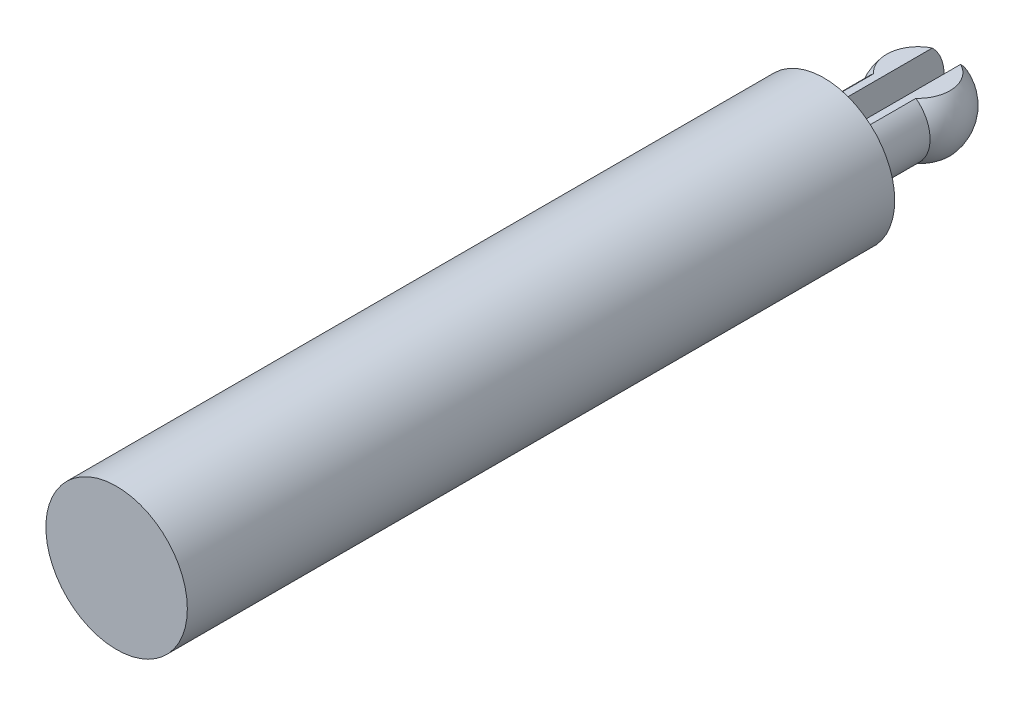
from build123d import *

# Parameters (mm, degrees)
SKETCH1_R           = 5
BOSS_EXTRUDE1_DEPTH = 50
SKETCH4_R           = 2.5
BOSS_EXTRUDE3_DEPTH = 5
SKETCH10_W          = 2
SKETCH10_H          = 10.578661844
CUT_EXTRUDE4_DEPTH  = 51.497524692
SKETCH11_W          = 10
SKETCH11_H          = 0.828427125
CUT_EXTRUDE5_DEPTH  = 51.497524692


with BuildPart() as part:
    # Sketch1 → Boss-Extrude1 (new body)
    with BuildSketch(Plane.XY):
        Circle(SKETCH1_R)
    extrude(amount=BOSS_EXTRUDE1_DEPTH)

    # Sketch4 → Boss-Extrude3 (add)
    with BuildSketch(Plane(origin=(0, 0, 0), x_dir=(-1, 0, 0), z_dir=(0, 0, -1))):
        Circle(SKETCH4_R)
    extrude(amount=BOSS_EXTRUDE3_DEPTH)

    # Sketch8 → Revolve1 (revolve)
    with BuildSketch(Plane(origin=(0, 0, 0), x_dir=(0, 0, -1), z_dir=(1, 0, 0))):
        with BuildLine():
            Line((6.658312395, 3), (6.658312395, -3))
            ThreePointArc((6.658312395, -3), (3.658312395, 0), (6.658312395, 3))
        make_face()
    revolve(axis=Axis((0, 3, -6.658312395), (0, -1, 0)))

    # Sketch10 → Cut-Extrude4 (cut, through all)
    with BuildSketch(Plane(origin=(0, 0, 0), x_dir=(-1, 0, 0), z_dir=(0, 0, -1))):
        Rectangle(SKETCH10_W, SKETCH10_H)
    extrude(amount=CUT_EXTRUDE4_DEPTH, mode=Mode.SUBTRACT)

    # Sketch11 → Cut-Extrude5 (cut, through all)
    with BuildSketch(Plane(origin=(0, 0, 0), x_dir=(-1, 0, 0), z_dir=(0, 0, -1))):
        with Locations((0, 2.414213563)):
            Rectangle(SKETCH11_W, SKETCH11_H)
        with Locations((0, -2.414213563)):
            Rectangle(SKETCH11_W, SKETCH11_H)
    extrude(amount=CUT_EXTRUDE5_DEPTH, mode=Mode.SUBTRACT)


solid = part.part
